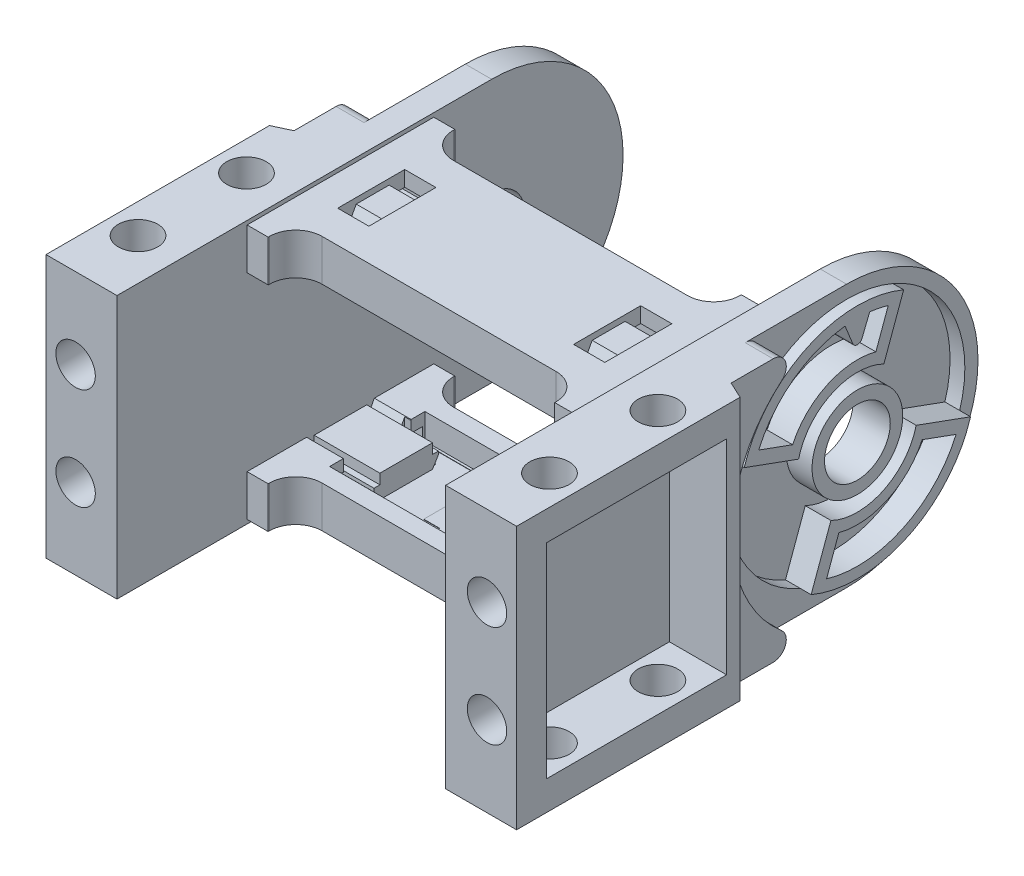
from build123d import *

# Parameters (mm, degrees)
BOSS_EXTRUDE1_DEPTH  = 2
BOSS_EXTRUDE3_START  = 2.25
BOSS_EXTRUDE3_DEPTH  = 2.25
SKETCH6_R            = 5
BOSS_EXTRUDE5_DEPTH  = 4
SKETCH7_R            = 18
CUT_EXTRUDE1_DEPTH   = 2.25
BOSS_EXTRUDE6_START  = 3.9
SKETCH8_R            = 6.9
SKETCH8_R_2          = 5
BOSS_EXTRUDE6_DEPTH  = 3.9
BOSS_EXTRUDE7_REACH  = 71.195
BOSS_EXTRUDE8_DEPTH  = 10
BOSS_EXTRUDE9_DEPTH  = 4.3
BOSS_EXTRUDE11_START = -6.25
BOSS_EXTRUDE11_DEPTH = 6.25
BOSS_EXTRUDE12_DEPTH = 40
SKETCH23_W           = 27.4
SKETCH23_H           = 31.1
CUT_EXTRUDE7_DEPTH   = 8.7
SKETCH24_R           = 3
CUT_EXTRUDE8_DEPTH   = 86.07432045
CUT_EXTRUDE9_REACH   = 89.239
SKETCH25_R           = 3
SKETCH17_W           = 4.75
SKETCH17_H           = 10.2
BOSS_EXTRUDE10_DEPTH = 6.3
SKETCH18_W           = 13.78
SKETCH18_H           = 2.15
CUT_EXTRUDE3_DEPTH   = 15.8
CUT_EXTRUDE4_DEPTH   = 11.25
CUT_EXTRUDE5_START   = -3.95
SKETCH20_W           = 7
SKETCH20_H           = 1
CUT_EXTRUDE5_DEPTH   = 3.95
SKETCH21_W           = 38.8
SKETCH21_H           = 14.5
CUT_EXTRUDE6_DEPTH   = 3.9


with BuildPart() as part:
    # Sketch1 → Boss-Extrude1 (new body)
    with BuildSketch(Plane(origin=(31.25, 0, 0), x_dir=(0, 0, -1), z_dir=(1, 0, 0))):
        with BuildLine():
            Line((-11, 20), (30.582801811, 20))
            ThreePointArc((30.582801811, 20), (32.458698221, 18.693550761), (31.883831194, 16.481012658))
            ThreePointArc((31.883831194, 16.481012658), (24.3, 0), (31.883831194, -16.481012658))
            ThreePointArc((31.883831194, -16.481012658), (32.458698221, -18.693550761), (30.582801811, -20))
            Line((30.582801811, -20), (-11, -20))
            Line((-11, -20), (-11, 20))
        make_face()
    extrude(amount=BOSS_EXTRUDE1_DEPTH)

    # Sketch3 → Boss-Extrude3 (add)
    with BuildSketch(Plane.ZY.offset(-31.25).offset(BOSS_EXTRUDE3_START)):
        with BuildLine():
            Line((-30.582801811, -20), (11, -20))
            Line((11, -20), (11, 20))
            Line((11, 20), (-30.582801811, 20))
            ThreePointArc((-30.582801811, 20), (-32.458698221, 18.693550761), (-31.883831194, 16.481012658))
            ThreePointArc((-31.883831194, 16.481012658), (-24.3, 0), (-31.883831194, -16.481012658))
            ThreePointArc((-31.883831194, -16.481012658), (-32.458698221, -18.693550761), (-30.582801811, -20))
        make_face()
    extrude(amount=-BOSS_EXTRUDE3_DEPTH)

    # Sketch6 → Boss-Extrude5 (add)
    with BuildSketch(Plane(origin=(29, 0, 0), x_dir=(0, 0, -1), z_dir=(1, 0, 0))):
        with BuildLine():
            Line((13.33266665, 20), (46, 20))
            ThreePointArc((46, 20), (66, 0), (46, -20))
            Line((46, -20), (13.33266665, -20))
            ThreePointArc((13.33266665, -20), (11.433418679, -18.626783171), (12.142249985, -16.392857143))
            ThreePointArc((12.142249985, -16.392857143), (20.4, 0), (12.142249985, 16.392857143))
            ThreePointArc((12.142249985, 16.392857143), (11.433418679, 18.626783171), (13.33266665, 20))
        make_face()
        with Locations((46, 0)):
            Circle(SKETCH6_R, mode=Mode.SUBTRACT)
    extrude(amount=-BOSS_EXTRUDE5_DEPTH)

    # Sketch7 → Cut-Extrude1 (cut)
    with BuildSketch(Plane(origin=(29, 0, 0), x_dir=(0, 0, -1), z_dir=(1, 0, 0))):
        with Locations((46, 0)):
            Circle(SKETCH7_R)
    extrude(amount=-CUT_EXTRUDE1_DEPTH, mode=Mode.SUBTRACT)

    # Sketch8 → Boss-Extrude6 (add)
    # profile 1 of 3: a face of its own
    with BuildSketch(Plane(origin=(26.75, 0, 0), x_dir=(0, 0, -1), z_dir=(1, 0, 0)).offset(BOSS_EXTRUDE6_START)):
        with Locations((46, 0)):
            Circle(SKETCH8_R)
        with Locations((46, 0)):
            Circle(SKETCH8_R_2, mode=Mode.SUBTRACT)
    # profile 2 of 3: a face of its own
    with BuildSketch(Plane(origin=(26.75, 0, 0), x_dir=(0, 0, -1), z_dir=(1, 0, 0)).offset(BOSS_EXTRUDE6_START)):
        with BuildLine():
            Line((53.040490335, 16.565974038), (50.031068965, 8.297656778))
            ThreePointArc((50.031068965, 8.297656778), (42.101346535, 8.360689335), (37.05250495, 2.245652986))
            Line((37.05250495, 2.245652986), (28.784187689, 5.255074356))
            ThreePointArc((28.784187689, 5.255074356), (38.392871289, 16.313540167), (53.040490335, 16.565974038))
        make_face()
        with BuildLine():
            Line((50.689873826, 15.662936618), (48.81254202, 10.505009871))
            ThreePointArc((48.81254202, 10.505009871), (41.404026404, 9.856097184), (36.144828401, 4.597957999))
            Line((36.144828401, 4.597957999), (30.986901654, 6.475289806))
            ThreePointArc((30.986901654, 6.475289806), (39.090191421, 14.818132318), (50.689873826, 15.662936618))
        make_face(mode=Mode.SUBTRACT)
    # profile 3 of 3: a face of its own
    with BuildSketch(Plane(origin=(26.75, 0, 0), x_dir=(0, 0, -1), z_dir=(1, 0, 0)).offset(BOSS_EXTRUDE6_START)):
        with BuildLine():
            Line((41.968931035, -8.297656778), (38.959509665, -16.565974038))
            ThreePointArc((38.959509665, -16.565974038), (53.607128711, -16.313540167), (63.215812311, -5.255074356))
            Line((63.215812311, -5.255074356), (54.94749505, -2.245652986))
            ThreePointArc((54.94749505, -2.245652986), (49.898653465, -8.360689335), (41.968931035, -8.297656778))
        make_face()
        with BuildLine():
            Line((41.310126174, -15.662936618), (43.18745798, -10.505009871))
            ThreePointArc((43.18745798, -10.505009871), (50.595973596, -9.856097184), (55.855171599, -4.597957999))
            Line((55.855171599, -4.597957999), (61.013098346, -6.475289806))
            ThreePointArc((61.013098346, -6.475289806), (52.909808579, -14.818132318), (41.310126174, -15.662936618))
        make_face(mode=Mode.SUBTRACT)
    extrude(amount=-BOSS_EXTRUDE6_DEPTH)

    # Sketch9 → Boss-Extrude7 (add, up to next)
    with BuildSketch(Plane(origin=(30.65, 0, 0), x_dir=(0, 0, -1), z_dir=(1, 0, 0)), mode=Mode.PRIVATE) as boss_extrude7_sk1:
        with BuildLine():
            Line((44.125, 16.242132711), (45.304497128, 13.319329812))
            ThreePointArc((45.304497128, 13.319329812), (46, 12.85), (46.695502872, 13.319329812))
            Line((46.695502872, 13.319329812), (47.875, 16.242132711))
            ThreePointArc((47.875, 16.242132711), (46, 16.35), (44.125, 16.242132711))
        make_face()
    boss_extrude7_tool1 = extrude(boss_extrude7_sk1.sketch, amount=-BOSS_EXTRUDE7_REACH, mode=Mode.PRIVATE) - part.part
    add(boss_extrude7_tool1.solids().sort_by_distance((30.65, 14.938571, -46))[0])

    # Sketch11 → Boss-Extrude8 (add)
    with BuildSketch(Plane.ZY.offset(-25)):
        Polygon((-27, 13.4), (-27, 14.94), (-27.9, 14.94), (-27.9, 15.44), (-27, 16.9), (-19, 16.9), (-18.1, 15.44), (-18.1, 14.94), (-19, 14.94), (-19, 13.4), align=None)
        Polygon((-19, -13.4), (-19, -14.94), (-18.1, -14.94), (-18.1, -15.44), (-19, -16.9), (-27, -16.9), (-27.9, -15.44), (-27.9, -14.94), (-27, -14.94), (-27, -13.4), align=None)
    extrude(amount=BOSS_EXTRUDE8_DEPTH)

    # Sketch15 → Boss-Extrude9 (add)
    with BuildSketch(Plane.ZY.offset(-15.8)):
        Polygon((-25.5, 18.75), (-20.5, 18.75), (-19.5, 16.9), (-26.5, 16.9), align=None)
    boss_extrude9 = extrude(amount=-BOSS_EXTRUDE9_DEPTH)

    # Эскиз1<2> → Boss-Extrude11 (add)
    with BuildSketch(Plane(origin=(31.25, 0, 0), x_dir=(0, 0, -1), z_dir=(1, 0, 0)).offset(BOSS_EXTRUDE11_START)):
        with BuildLine():
            Line((-11, 20), (30.582801811, 20))
            ThreePointArc((30.582801811, 20), (32.458698221, 18.693550761), (31.883831194, 16.481012658))
            ThreePointArc((31.883831194, 16.481012658), (24.3, 0), (31.883831194, -16.481012658))
            ThreePointArc((31.883831194, -16.481012658), (32.458698221, -18.693550761), (30.582801811, -20))
            Line((30.582801811, -20), (-11, -20))
            Line((-11, -20), (-11, 20))
        make_face()
    extrude(amount=BOSS_EXTRUDE11_DEPTH)

    # Sketch22 → Boss-Extrude12 (add)
    with BuildSketch(Plane(origin=(0, 20, 0), x_dir=(1, 0, 0), z_dir=(0, 1, 0))):
        Polygon((33.25, -11), (35.8, -11), (35.8, 23), (33.25, 24.189084528), align=None)
    extrude(amount=-BOSS_EXTRUDE12_DEPTH)

    # Sketch23 → Cut-Extrude7 (cut)
    with BuildSketch(Plane(origin=(35.8, 0, 0), x_dir=(0, 0, -1), z_dir=(1, 0, 0))):
        with Locations((7.25, 0)):
            Rectangle(SKETCH23_W, SKETCH23_H)
    extrude(amount=-CUT_EXTRUDE7_DEPTH, mode=Mode.SUBTRACT)

    # Sketch24 → Cut-Extrude8 (cut, through all)
    with BuildSketch(Plane.XZ.offset(20)):
        with Locations(Location((31.3, 1.5, 0), (0, 0, 270))):
            Circle(SKETCH24_R)
        with Locations(Location((31.3, -15, 0), (0, 0, 270))):
            Circle(SKETCH24_R)
    extrude(amount=-CUT_EXTRUDE8_DEPTH, mode=Mode.SUBTRACT)

    # Sketch25 → Cut-Extrude9 (cut, up to next)
    with BuildSketch(Plane.XY.offset(11), mode=Mode.PRIVATE) as cut_extrude9_sk1:
        with Locations((31.3, -7.75)):
            Circle(SKETCH25_R)
    cut_extrude9_tool1 = extrude(cut_extrude9_sk1.sketch, amount=-CUT_EXTRUDE9_REACH, mode=Mode.PRIVATE) & part.part
    # Sketch25 → Cut-Extrude9 (cut, up to next)
    with BuildSketch(Plane.XY.offset(11), mode=Mode.PRIVATE) as cut_extrude9_sk2:
        with Locations((31.3, 7.75)):
            Circle(SKETCH25_R)
    cut_extrude9_tool2 = extrude(cut_extrude9_sk2.sketch, amount=-CUT_EXTRUDE9_REACH, mode=Mode.PRIVATE) & part.part
    add(cut_extrude9_tool1.solids().sort_by_distance((31.3, -7.75, 11))[0], mode=Mode.SUBTRACT)
    add(cut_extrude9_tool2.solids().sort_by_distance((31.3, 7.75, 11))[0], mode=Mode.SUBTRACT)

    # Mirror1: Boss-Extrude9 across plane
    add(boss_extrude9.mirror(Plane.ZX))


with BuildPart() as body_2:
    # Mirror2: mirrored copy
    add(part.part.mirror(Plane(origin=(0, 0, 0), x_dir=(0, 0, 1), z_dir=(1, 0, 0))))


with BuildPart() as body_3:
    # Sketch17 → Boss-Extrude10 (new body)
    with BuildSketch(Plane(origin=(0, 19.4, 0), x_dir=(1, 0, 0), z_dir=(0, 1, 0))):
        with BuildLine():
            Line((21.8, 9), (21.8, 8.8))
            Line((21.8, 8.8), (25, 8.8))
            Line((25, 8.8), (25, 37.2))
            Line((25, 37.2), (21.8, 37.2))
            Line((21.8, 37.2), (21.8, 37))
            ThreePointArc((21.8, 37), (20.628427125, 34.171572875), (17.8, 33))
            Line((17.8, 33), (-17.8, 33))
            ThreePointArc((-17.8, 33), (-20.628427125, 34.171572875), (-21.8, 37))
            Line((-21.8, 37), (-21.8, 37.2))
            Line((-21.8, 37.2), (-25, 37.2))
            Line((-25, 37.2), (-25, 8.8))
            Line((-25, 8.8), (-21.8, 8.8))
            Line((-21.8, 8.8), (-21.8, 9))
            ThreePointArc((-21.8, 9), (-20.628427125, 11.828427125), (-17.8, 13))
            Line((-17.8, 13), (17.8, 13))
            ThreePointArc((17.8, 13), (20.628427125, 11.828427125), (21.8, 9))
        make_face()
        with Locations((17.95, 23)):
            Rectangle(SKETCH17_W, SKETCH17_H, mode=Mode.SUBTRACT)
        with Locations((-17.95, 23)):
            Rectangle(SKETCH17_W, SKETCH17_H, mode=Mode.SUBTRACT)
    extrude(amount=-BOSS_EXTRUDE10_DEPTH)

    # Sketch18 → Cut-Extrude3 (cut)
    with BuildSketch(Plane(origin=(25, 0, 0), x_dir=(0, 0, -1), z_dir=(1, 0, 0))):
        with Locations((23, 15.975)):
            Rectangle(SKETCH18_W, SKETCH18_H)
    cut_extrude3 = extrude(amount=-CUT_EXTRUDE3_DEPTH, mode=Mode.SUBTRACT)

    # Sketch19 → Cut-Extrude4 (cut)
    with BuildSketch(Plane(origin=(25, 0, 0), x_dir=(0, 0, -1), z_dir=(1, 0, 0))):
        Polygon((18.8, 14.9), (17.85, 13.1), (28.15, 13.1), (27.2, 14.9), align=None)
    cut_extrude4 = extrude(amount=-CUT_EXTRUDE4_DEPTH, mode=Mode.SUBTRACT)

    # Sketch20 → Cut-Extrude5 (cut)
    with BuildSketch(Plane.XZ.offset(-13.1).offset(CUT_EXTRUDE5_START)):
        with Locations((10.25, -26.625)):
            Rectangle(SKETCH20_W, SKETCH20_H)
        with Locations((10.25, -19.375)):
            Rectangle(SKETCH20_W, SKETCH20_H)
    cut_extrude5 = extrude(amount=CUT_EXTRUDE5_DEPTH, mode=Mode.SUBTRACT)

    # Mirror5: Cut-Extrude3, Cut-Extrude4, Cut-Extrude5 across plane
    add(cut_extrude3.mirror(Plane(origin=(0, 0, 0), x_dir=(0, 0, 1), z_dir=(1, 0, 0))), mode=Mode.SUBTRACT)
    add(cut_extrude4.mirror(Plane(origin=(0, 0, 0), x_dir=(0, 0, 1), z_dir=(1, 0, 0))), mode=Mode.SUBTRACT)
    add(cut_extrude5.mirror(Plane(origin=(0, 0, 0), x_dir=(0, 0, 1), z_dir=(1, 0, 0))), mode=Mode.SUBTRACT)

    # Sketch21 → Cut-Extrude6 (cut)
    with BuildSketch(Plane.XZ.offset(-13.1)):
        with Locations((0, -23)):
            Rectangle(SKETCH21_W, SKETCH21_H)
    extrude(amount=-CUT_EXTRUDE6_DEPTH, mode=Mode.SUBTRACT)


with BuildPart() as body_4:
    # Mirror4: mirrored copy
    add(body_3.part.mirror(Plane.ZX))


solid = Compound([part.part, body_2.part, body_3.part, body_4.part])
